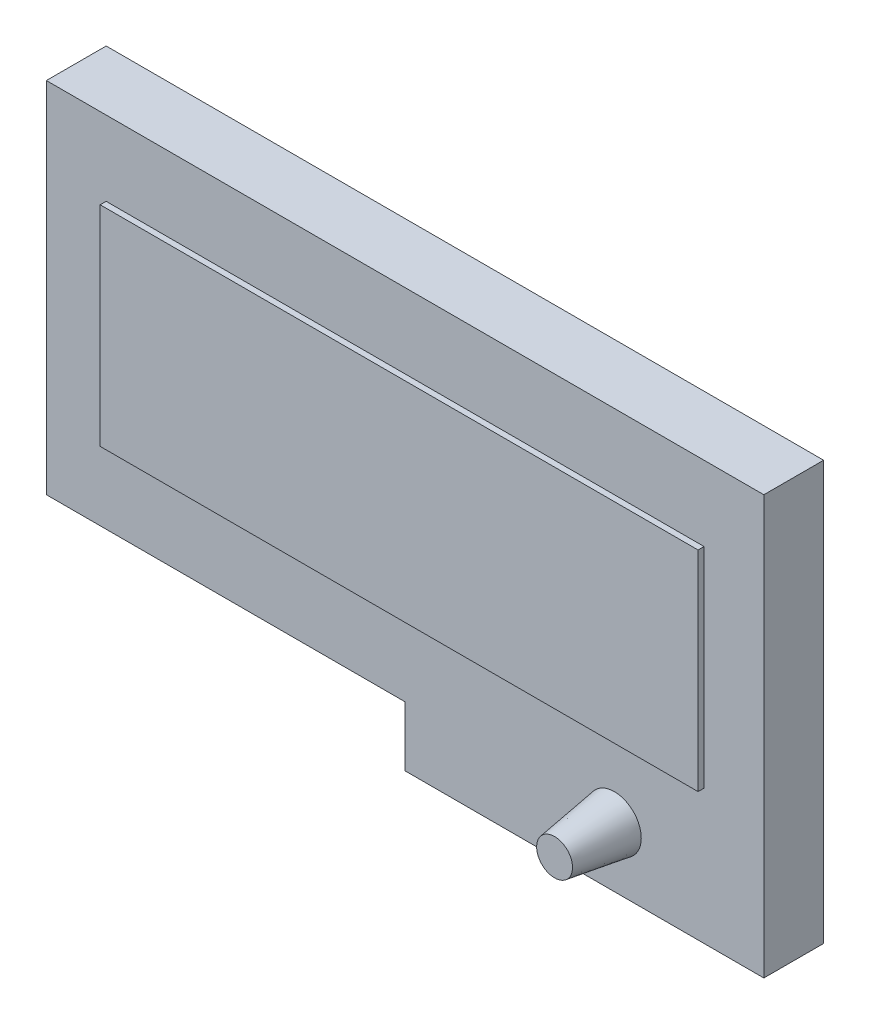
from build123d import *

# Parameters (mm, degrees)
ESTRUSIONE_ESTRUSIONE1_DEPTH = 10
SCHIZZO2_W                   = 100
SCHIZZO2_H                   = 35
ESTRUSIONE_ESTRUSIONE2_DEPTH = 1
SCHIZZO3_R                   = 4.5
SCHIZZO4_R                   = 3


with BuildPart() as part:
    # Schizzo1 → Estrusione-Estrusione1 (new body)
    with BuildSketch(Plane.XY):
        Polygon((-60, 60), (-60, 0), (0, 0), (0, -10), (60, -10), (60, 0.1203125), (60, 60), align=None)
    extrude(amount=ESTRUSIONE_ESTRUSIONE1_DEPTH)

    # Schizzo2 → Estrusione-Estrusione2 (add)
    with BuildSketch(Plane.XY.offset(10)):
        with Locations((0, 30)):
            Rectangle(SCHIZZO2_W, SCHIZZO2_H)
    extrude(amount=ESTRUSIONE_ESTRUSIONE2_DEPTH)

    # Schizzo3 → Loft1 section 0
    with BuildSketch(Plane.XY.offset(10)):
        with Locations((35, 0)):
            Circle(SCHIZZO3_R)
    # Schizzo4 → Loft1 section 1
    with BuildSketch(Plane.XY.offset(20)):
        with Locations((35, 0)):
            Circle(SCHIZZO4_R)
    loft()


solid = part.part
